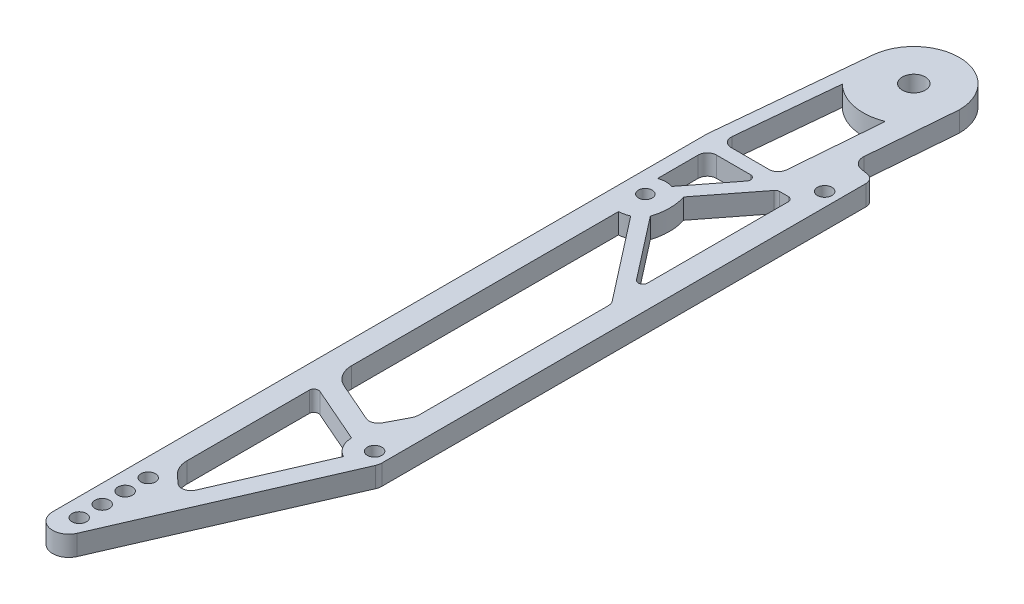
from build123d import *

# Parameters (mm, degrees)
SKETCH2_R           = 3.175
SKETCH2_R_2         = 2
SKETCH2_R_3         = 1.905
SKETCH2_R_4         = 1.999999991
BOSS_EXTRUDE1_DEPTH = 5.588


with BuildPart() as part:
    # Sketch2 → Boss-Extrude1 (new body)
    with BuildSketch(Plane(origin=(0, 0, 0), x_dir=(1, 0, 0), z_dir=(0, 1, 0))):
        with BuildLine():
            Line((15.15555913, -28.018449791), (13.238676936, -27.713033224))
            ThreePointArc((13.238676936, -27.713033224), (11.241051513, -26.538356195), (10.573787778, -24.319092227))
            Line((10.573787778, -24.319092227), (12.5603, 0))
            ThreePointArc((12.5603, 0), (0.601023521, 12.545911956), (-12.502780789, 1.200670076))
            Line((-12.502780789, 1.200670076), (-16.492552312, -40.345496304))
            ThreePointArc((-16.492552312, -40.345496304), (-16.505635578, -40.527391114), (-16.51, -40.709703607))
            Line((-16.51, -40.709703607), (-16.51, -221.328861788))
            ThreePointArc((-16.51, -221.328861788), (-12.970187584, -225.680718913), (-7.988667969, -223.101301399))
            Line((-7.988667969, -223.101301399), (16.979901226, -165.677523619))
            ThreePointArc((16.979901226, -165.677523619), (17.216065593, -164.934164738), (17.295902343, -164.158289667))
            Line((17.295902343, -164.158289667), (17.295902343, -30.526810701))
            ThreePointArc((17.295902343, -30.526810701), (16.688093876, -28.878103365), (15.15555913, -28.018449791))
        make_face()
        with Locations(Location((0, 0, 0), (0, 0, 270))):
            Circle(SKETCH2_R, mode=Mode.SUBTRACT)
        with Locations(Location((-11.43, -219.075, 0), (0, 0, 270))):
            Circle(SKETCH2_R_2, mode=Mode.SUBTRACT)
        with Locations(Location((-11.43, -212.725, 0), (0, 0, 270))):
            Circle(SKETCH2_R_2, mode=Mode.SUBTRACT)
        with Locations(Location((-11.43, -206.375, 0), (0, 0, 270))):
            Circle(SKETCH2_R_2, mode=Mode.SUBTRACT)
        with Locations(Location((-11.43, -200.025, 0), (0, 0, 270))):
            Circle(SKETCH2_R_2, mode=Mode.SUBTRACT)
        with Locations(Location((-10.6553, -63.5, 0), (0, 0, 270))):
            Circle(SKETCH2_R_3, mode=Mode.SUBTRACT)
        with Locations(Location((13.485902343, -38.1, 0), (0, 0, 270))):
            Circle(SKETCH2_R_4, mode=Mode.SUBTRACT)
        with Locations(Location((13.485902343, -162.410770806, 0), (0, 0, 270))):
            Circle(SKETCH2_R_2, mode=Mode.SUBTRACT)
        with BuildLine():
            Line((10.438542905, -167.981776143), (-1.917547411, -196.39883837))
            ThreePointArc((-1.917547411, -196.39883837), (-3.730878547, -197.873050616), (-5.981020282, -197.241913761))
            Line((-5.981020282, -197.241913761), (-8.145350704, -195.219576049))
            ThreePointArc((-8.145350704, -195.219576049), (-9.634602002, -193.108963545), (-10.16, -190.579830983))
            Line((-10.16, -190.579830983), (-10.16, -156.802168612))
            ThreePointArc((-10.16, -156.802168612), (-9.585607464, -155.739610257), (-8.381999597, -155.638194561))
            Line((-8.381999597, -155.638194561), (7.135902343, -162.410768606))
            ThreePointArc((7.135902343, -162.410768606), (8.0236114, -165.648961297), (10.438542905, -167.981776143))
        make_face(mode=Mode.SUBTRACT)
        with BuildLine():
            Line((10.945902343, -147.517141807), (10.945902343, -95.265809134))
            ThreePointArc((10.945902343, -95.265809134), (10.80854708, -94.441856302), (10.411336777, -93.70701706))
            Line((10.411336777, -93.70701706), (-7.433233368, -70.749423162))
            ThreePointArc((-7.433233368, -70.749423162), (-8.766818111, -71.205159681), (-10.16, -71.417734996))
            Line((-10.16, -71.417734996), (-10.16, -145.162426346))
            ThreePointArc((-10.16, -145.162426346), (-9.122791771, -148.640463666), (-6.350002016, -150.982296599))
            Line((-6.350002016, -150.982296599), (4.488151635, -155.712459117))
            ThreePointArc((4.488151635, -155.712459117), (6.348753278, -155.779975361), (7.755557144, -154.560426346))
            Line((7.755557144, -154.560426346), (10.513009397, -149.281014802))
            ThreePointArc((10.513009397, -149.281014802), (10.836096789, -148.425250314), (10.945902343, -147.517141807))
        make_face(mode=Mode.SUBTRACT)
        with BuildLine():
            Line((-4.65837794, -58.888907788), (6.271106887, -44.827785995))
            ThreePointArc((6.271106887, -44.827785995), (6.715672228, -44.466407521), (7.273824104, -44.337182032))
            Line((7.273824104, -44.337182032), (9.675902343, -44.337182032))
            ThreePointArc((9.675902343, -44.337182032), (10.573927955, -44.70915642), (10.945902343, -45.607182032))
            Line((10.945902343, -45.607182032), (10.945902343, -84.483166252))
            ThreePointArc((10.945902343, -84.483166252), (10.087878759, -85.684488621), (8.673185126, -85.26256229))
            Line((8.673185126, -85.26256229), (-4.65837794, -68.111092212))
            ThreePointArc((-4.65837794, -68.111092212), (-3.931340897, -63.5), (-4.65837794, -58.888907788))
        make_face(mode=Mode.SUBTRACT)
        with BuildLine():
            Line((-12.415233052, -37.744377163), (-9.751235062, -10.003715048))
            ThreePointArc((-9.751235062, -10.003715048), (-2.753398549, -13.695973731), (5.127655889, -12.99492382))
            Line((5.127655889, -12.99492382), (3.069264048, -38.19397392))
            ThreePointArc((3.069264048, -38.19397392), (2.259083254, -39.854914801), (0.537695935, -40.527182032))
            Line((0.537695935, -40.527182032), (-9.886864844, -40.527182032))
            ThreePointArc((-9.886864844, -40.527182032), (-11.766801594, -39.695232914), (-12.415233052, -37.744377163))
        make_face(mode=Mode.SUBTRACT)
        with BuildLine():
            Line((-0.768822282, -44.337182032), (-10.142472044, -44.337182032))
            ThreePointArc((-10.142472044, -44.337182032), (-11.938523268, -45.081130808), (-12.682472044, -46.877182032))
            Line((-12.682472044, -46.877182032), (-12.682472044, -58.093297101))
            ThreePointArc((-12.682472044, -58.093297101), (-10.75401097, -57.726602484), (-8.814141549, -58.027158116))
            Line((-8.814141549, -58.027158116), (0.233894935, -46.386578069))
            ThreePointArc((0.233894935, -46.386578069), (0.371952228, -45.049030156), (-0.768822282, -44.337182032))
        make_face(mode=Mode.SUBTRACT)
    extrude(amount=BOSS_EXTRUDE1_DEPTH)


solid = part.part
